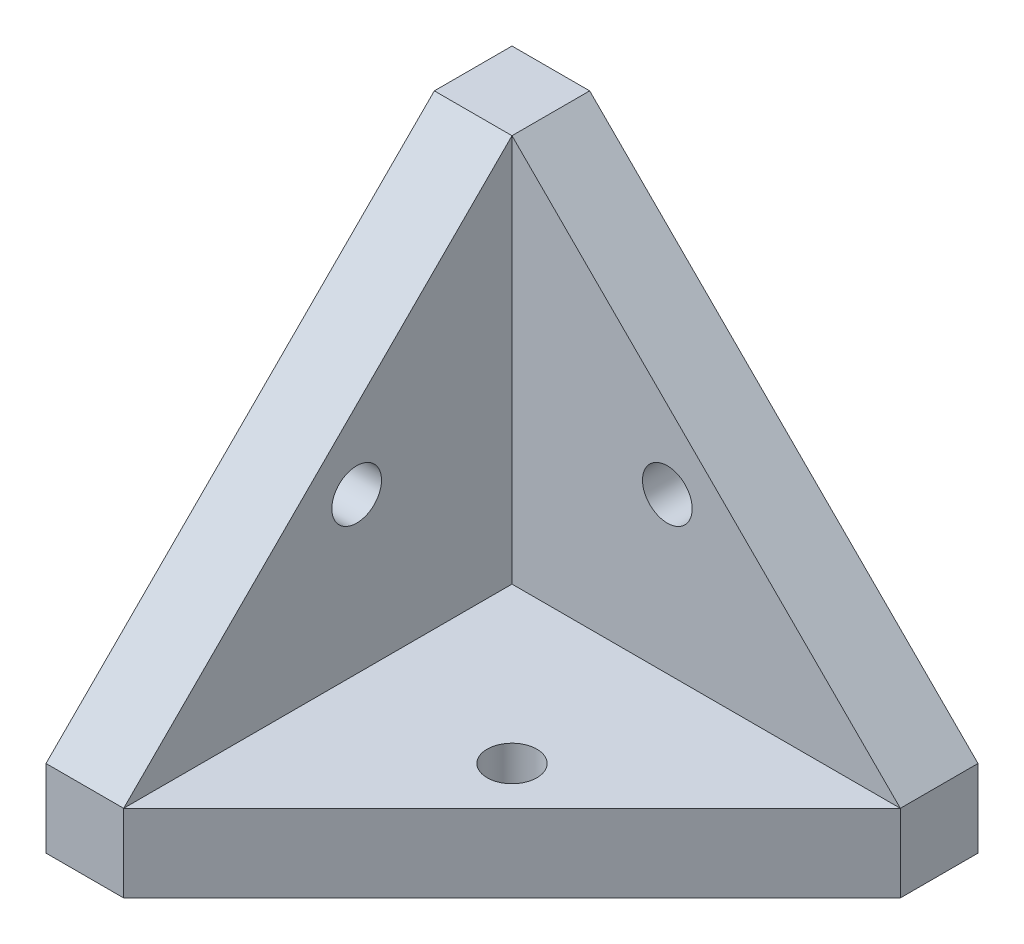
from build123d import *

# Parameters (mm, degrees)
AUFSATZ_LINEAR_AUSTRAGEN2_DEPTH = 5
AUFSATZ_LINEAR_AUSTRAGEN3_DEPTH = 30
FASE3_SIZE                      = 25
SKIZZE3_R                       = 1.6
SCHNITT_LINEAR_AUSTRAGEN2_DEPTH = 30
SKIZZE4_R                       = 1.6
SCHNITT_LINEAR_AUSTRAGEN3_DEPTH = 30
SKIZZE5_R                       = 1.6
SCHNITT_LINEAR_AUSTRAGEN4_DEPTH = 30


with BuildPart() as part:
    # Skizze1 → Aufsatz-Linear austragen2 (new body)
    with BuildSketch(Plane.XY):
        Polygon((5, 5), (30, 5), (5, 30), align=None)
    extrude(amount=AUFSATZ_LINEAR_AUSTRAGEN2_DEPTH)

    # Skizze1<5> → Aufsatz-Linear austragen3 (add)
    with BuildSketch(Plane.XY):
        Polygon((0, 30), (0, 0), (30, 0), (30, 5), (5, 5), (5, 30), align=None)
    extrude(amount=AUFSATZ_LINEAR_AUSTRAGEN3_DEPTH)

    # Fase3
    fase3_edges = [part.edges().sort_by_distance(p)[0] for p in [
        (2.5, 30, 30),
        (30, 2.5, 30),
    ]]
    chamfer(fase3_edges, length=FASE3_SIZE)

    # Skizze3 → Schnitt-Linear austragen2 (cut)
    with BuildSketch(Plane(origin=(0, 5, 0), x_dir=(1, 0, 0), z_dir=(0, 1, 0))):
        with Locations((15, -15)):
            Circle(SKIZZE3_R)
    extrude(amount=-SCHNITT_LINEAR_AUSTRAGEN2_DEPTH, mode=Mode.SUBTRACT)

    # Skizze4 → Schnitt-Linear austragen3 (cut)
    with BuildSketch(Plane(origin=(5, 0, 0), x_dir=(0, 0, -1), z_dir=(1, 0, 0))):
        with Locations((-15, 15)):
            Circle(SKIZZE4_R)
    extrude(amount=-SCHNITT_LINEAR_AUSTRAGEN3_DEPTH, mode=Mode.SUBTRACT)

    # Skizze5 → Schnitt-Linear austragen4 (cut)
    with BuildSketch(Plane.XY.offset(5)):
        with Locations((15, 15)):
            Circle(SKIZZE5_R)
    extrude(amount=-SCHNITT_LINEAR_AUSTRAGEN4_DEPTH, mode=Mode.SUBTRACT)


solid = part.part
